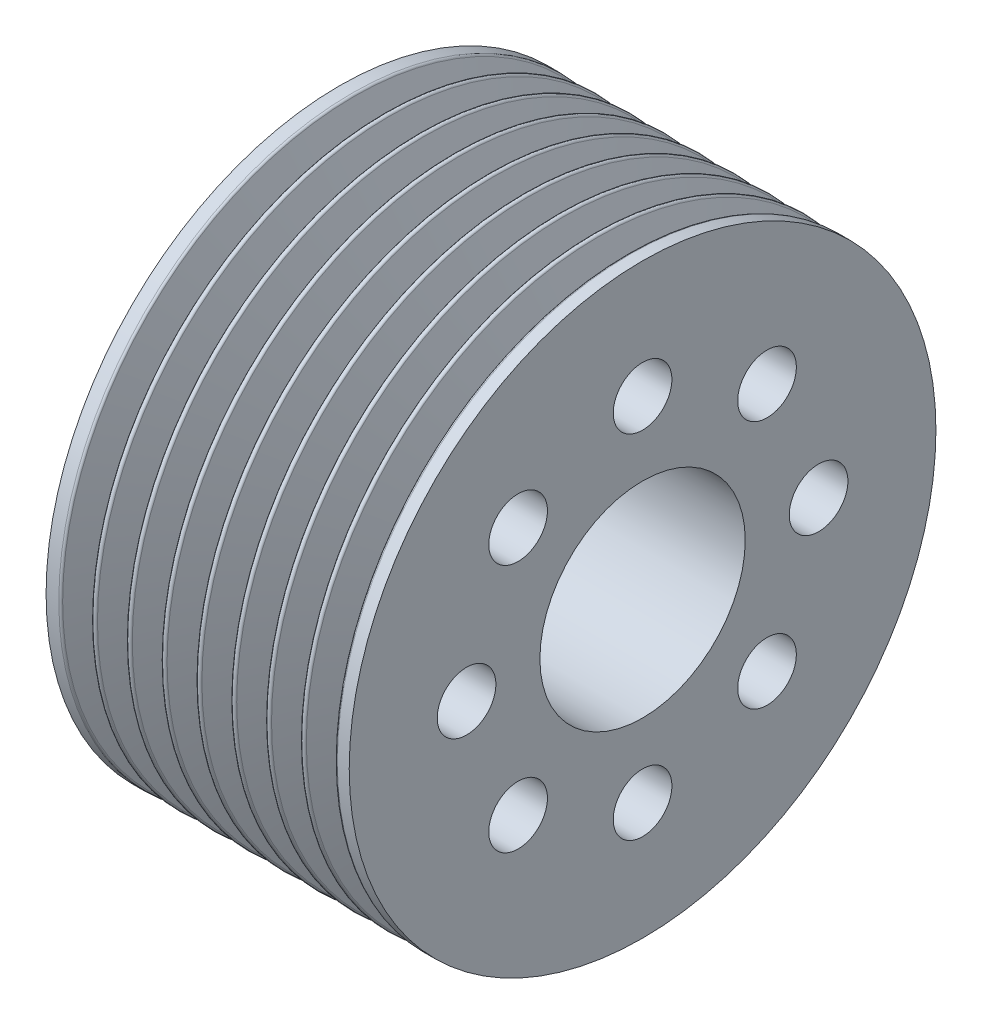
from build123d import *

# Parameters (mm, degrees)
LPATTERN1_COUNT    = 8
LPATTERN1_PITCH    = 3.56
SKETCH3_R          = 3
CUT_EXTRUDE1_DEPTH = 17.5


with BuildPart() as part:
    # Sketch1 → Revolve1 (revolve)
    with BuildSketch(Plane.XY, mode=Mode.PRIVATE) as revolve1_sk:
        Polygon((49, 10.5), (49, 30), (18, 30), (18, 21.5), (31.5, 21.5), (31.5, 10.5), align=None)
    revolve(revolve1_sk.sketch.rotate(Axis((0, 0, 0), (1, 0, 0)), 90), axis=Axis((0, 0, 0), (1, 0, 0)))

    # Sketch2 → Cut-Revolve1 (revolve, cut)
    with BuildSketch(Plane.XY, mode=Mode.PRIVATE) as cut_revolve1_sk:
        with BuildLine():
            Line((47.545831953, 29.837551845), (46.281001657, 26.45460955))
            ThreePointArc((46.281001657, 26.45460955), (46, 26.259671764), (45.718998343, 26.45460955))
            Line((45.718998343, 26.45460955), (44.454168047, 29.837551845))
            ThreePointArc((44.454168047, 29.837551845), (44.362499191, 29.955411734), (44.22, 30))
            Line((44.22, 30), (47.78, 30))
            ThreePointArc((47.78, 30), (47.637500809, 29.955411734), (47.545831953, 29.837551845))
        make_face()
    cut_revolve1 = revolve(cut_revolve1_sk.sketch.rotate(Axis((0, 0, 0), (1, 0, 0)), 90), axis=Axis((0, 0, 0), (1, 0, 0)), mode=Mode.SUBTRACT)

    # LPattern1: Cut-Revolve1 ×8
    with Locations(*[(-i * LPATTERN1_PITCH, 0, 0) for i in range(1, LPATTERN1_COUNT)]):
        add(cut_revolve1, mode=Mode.SUBTRACT)

    # Sketch3 → Cut-Extrude1 (cut)
    with BuildSketch(Plane(origin=(49, 0, 0), x_dir=(0, 0, -1), z_dir=(1, 0, 0))):
        with Locations((0, 18)):
            Circle(SKETCH3_R)
        with Locations((12.727922061, 12.727922061)):
            Circle(SKETCH3_R)
        with Locations((18, 0)):
            Circle(SKETCH3_R)
        with Locations((12.727922061, -12.727922061)):
            Circle(SKETCH3_R)
        with Locations((0, -18)):
            Circle(SKETCH3_R)
        with Locations((-12.727922061, -12.727922061)):
            Circle(SKETCH3_R)
        with Locations((-18, 0)):
            Circle(SKETCH3_R)
        with Locations((-12.727922061, 12.727922061)):
            Circle(SKETCH3_R)
    extrude(amount=-CUT_EXTRUDE1_DEPTH, mode=Mode.SUBTRACT)


solid = part.part
